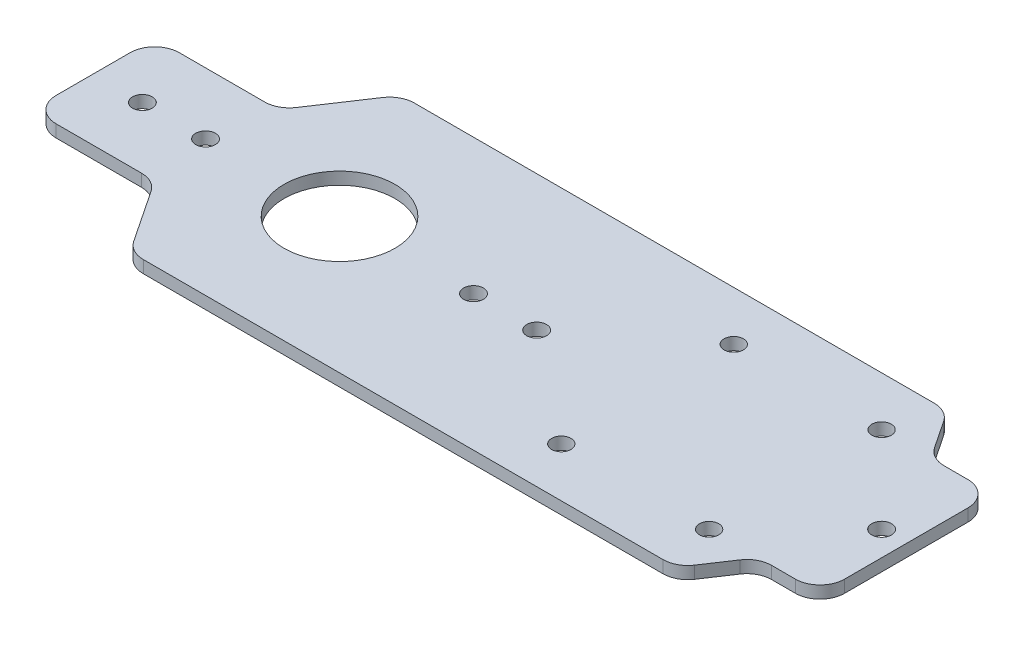
from build123d import *

# Parameters (mm, degrees)
SKETCH1_R           = 2.54
BOSS_EXTRUDE1_DEPTH = 3.175
SKETCH2_R           = 14.2875
CUT_EXTRUDE1_DEPTH  = 3.175
SKETCH3_R           = 2.54
CUT_EXTRUDE2_DEPTH  = 120.558881937
SKETCH5_R           = 2.4892
SKETCH5_R_2         = 2.54
BOSS_EXTRUDE2_DEPTH = 3.175
FILLET1_R           = 6.35


with BuildPart() as part:
    # Sketch1 → Boss-Extrude1 (new body)
    with BuildSketch(Plane(origin=(0, 0, 0), x_dir=(1, 0, 0), z_dir=(0, 1, 0))):
        Polygon((19.05, 15.875), (31.75, 34.925), (69.85, 34.925), (82.55, 15.875), (114.3, 15.875), (114.3, -15.875), (82.55, -15.875), (69.85, -34.925), (31.75, -34.925), (19.05, -15.875), (-12.7, -15.875), (-12.7, 15.875), align=None)
        with Locations(Location((0, 0, 0), (0, 0, 270))):
            Circle(SKETCH1_R, mode=Mode.SUBTRACT)
        with Locations(Location((101.6, 0, 0), (0, 0, 270))):
            Circle(SKETCH1_R, mode=Mode.SUBTRACT)
    extrude(amount=BOSS_EXTRUDE1_DEPTH)

    # Sketch2 → Cut-Extrude1 (cut)
    with BuildSketch(Plane(origin=(0, 3.175, 0), x_dir=(1, 0, 0), z_dir=(0, 1, 0))):
        with Locations(Location((50.8, 0, 0), (0, 0, 270))):
            Circle(SKETCH2_R)
    extrude(amount=-CUT_EXTRUDE1_DEPTH, mode=Mode.SUBTRACT)

    # Sketch3 → Cut-Extrude2 (cut, through all)
    with BuildSketch(Plane(origin=(0, 3.175, 0), x_dir=(1, 0, 0), z_dir=(0, 1, 0))):
        with Locations(Location((85.331391081, 0, 0), (0, 0, 270))):
            Circle(SKETCH3_R)
        with Locations(Location((16.268608919, 0, 0), (0, 0, 270))):
            Circle(SKETCH3_R)
    extrude(amount=-CUT_EXTRUDE2_DEPTH, mode=Mode.SUBTRACT)

    # Sketch5 → Boss-Extrude2 (add)
    with BuildSketch(Plane.XZ):
        Polygon((69.85, 34.925), (69.85, -34.925), (172.508333333, -34.925), (180.975, -22.225), (196.85, -22.225), (196.85, 22.225), (180.975, 22.225), (172.508333333, 34.925), align=None)
        with Locations(Location((130.175, -22.225, 0), (0, 0, 270))):
            Circle(SKETCH5_R, mode=Mode.SUBTRACT)
        with Locations(Location((168.275, -22.225, 0), (0, 0, 270))):
            Circle(SKETCH5_R, mode=Mode.SUBTRACT)
        with Locations(Location((85.331391081, 0, 0), (0, 0, 90))):
            Circle(SKETCH5_R_2, mode=Mode.SUBTRACT)
        with Locations(Location((101.6, 0, 0), (0, 0, 90))):
            Circle(SKETCH5_R_2, mode=Mode.SUBTRACT)
        with Locations(Location((130.175, 22.225, 0), (0, 0, 270))):
            Circle(SKETCH5_R, mode=Mode.SUBTRACT)
        with Locations(Location((190.5, 0, 0), (0, 0, 270))):
            Circle(SKETCH5_R_2, mode=Mode.SUBTRACT)
        with Locations(Location((168.275, 22.225, 0), (0, 0, 270))):
            Circle(SKETCH5_R, mode=Mode.SUBTRACT)
    extrude(amount=-BOSS_EXTRUDE2_DEPTH)

    # Fillet1
    fillet1_edges = [part.edges().sort_by_distance(p)[0] for p in [
        (19.05, 1.5875, -15.875),
        (31.75, 1.5875, -34.925),
        (31.75, 1.5875, 34.925),
        (19.05, 1.5875, 15.875),
        (-12.7, 1.5875, 15.875),
        (-12.7, 1.5875, -15.875),
        (172.508333333, 1.5875, 34.925),
        (172.508333333, 1.5875, -34.925),
        (180.975, 1.5875, -22.225),
        (196.85, 1.5875, -22.225),
        (196.85, 1.5875, 22.225),
        (180.975, 1.5875, 22.225),
    ]]
    fillet(fillet1_edges, radius=FILLET1_R)


solid = part.part
